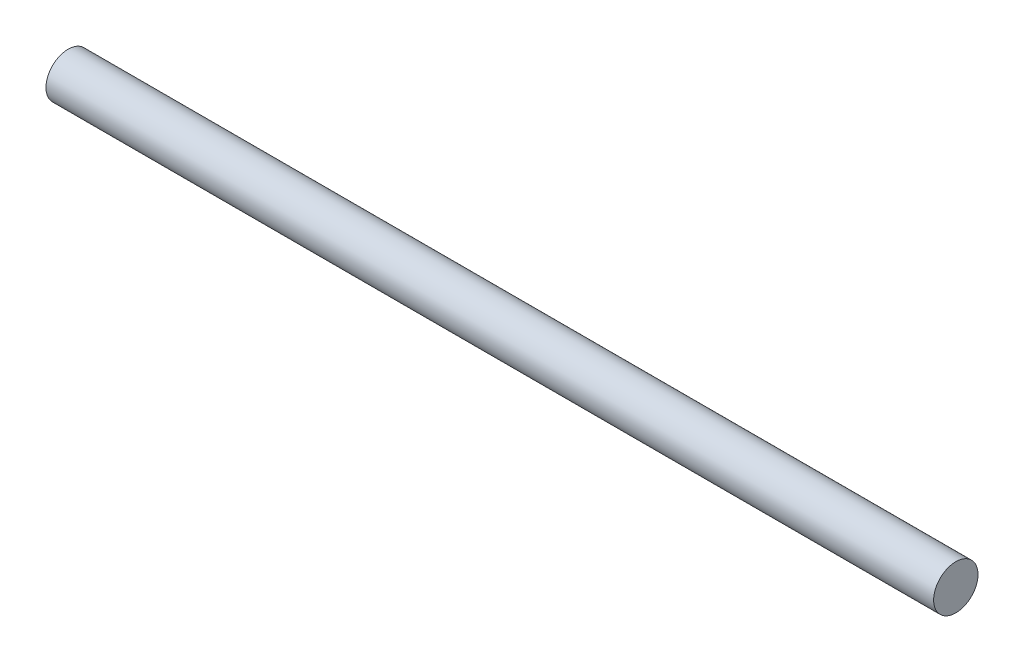
from build123d import *

# Parameters (mm, degrees)
SKETCH_1_R      = 2.5
EXTRUDE_1_DEPTH = 100


with BuildPart() as part:
    # 草圖1 → 填料-伸長1 (new body)
    with BuildSketch(Plane(origin=(0, 0, 0), x_dir=(0, 0, -1), z_dir=(1, 0, 0))):
        Circle(SKETCH_1_R)
    extrude(amount=EXTRUDE_1_DEPTH)


solid = part.part
